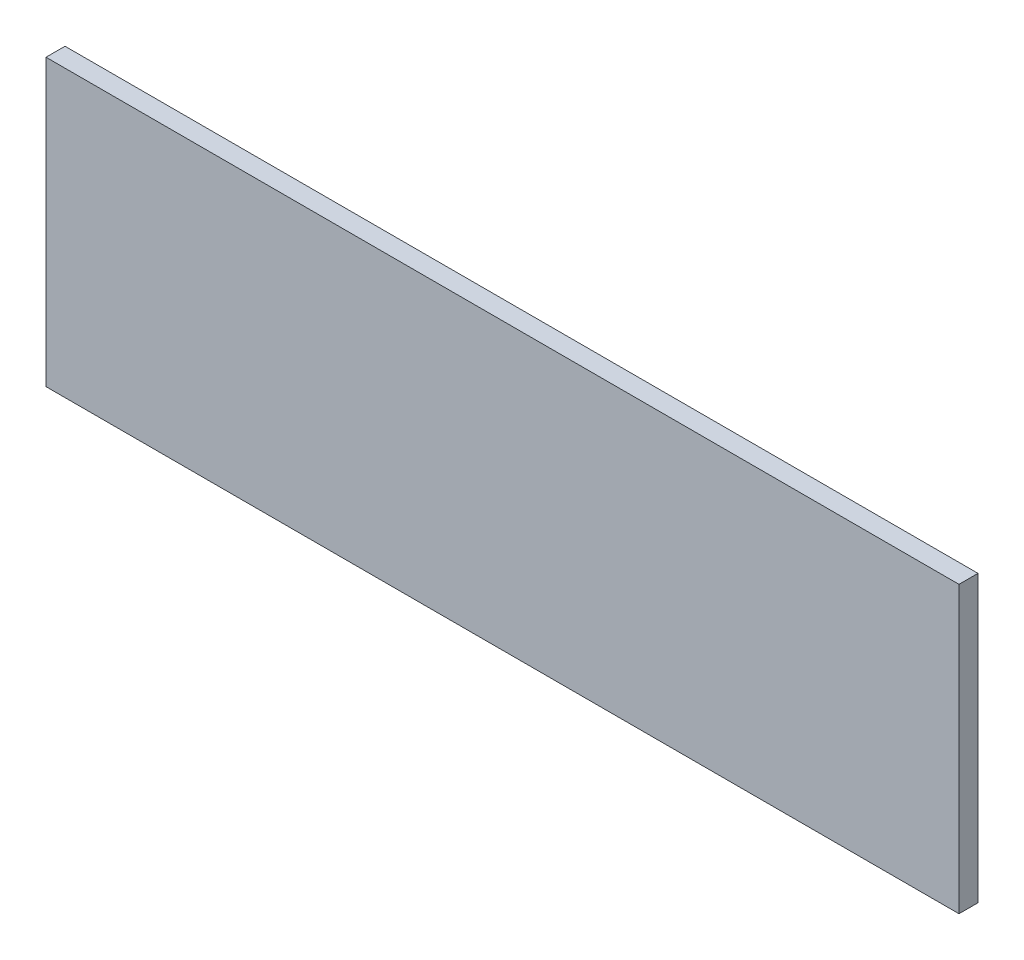
from build123d import *

# Parameters (mm, degrees)
SKETCH1_W           = 960
SKETCH1_H           = 300
BOSS_EXTRUDE2_DEPTH = 20


with BuildPart() as part:
    # Sketch1 → Boss-Extrude2 (new body)
    with BuildSketch(Plane.XY):
        with Locations((157.168141593, -28.513274336)):
            Rectangle(SKETCH1_W, SKETCH1_H)
    extrude(amount=BOSS_EXTRUDE2_DEPTH)


solid = part.part
